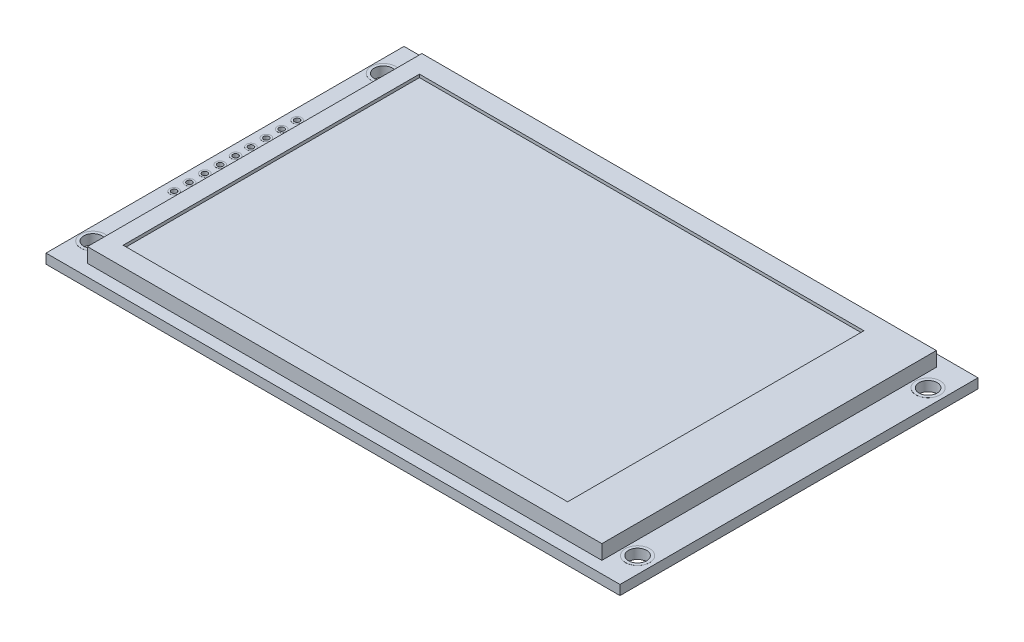
from build123d import *

# Parameters (mm, degrees)
SCHIZZO1_W                   = 94.84
SCHIZZO1_H                   = 59.15
ESTRUSIONE_ESTRUSIONE1_DEPTH = 0.8
SCHIZZO2_R                   = 1.5
TAGLIO_ESTRUSIONE1_DEPTH     = 56.909722097
SCHIZZO3_R                   = 0.445
TAGLIO_ESTRUSIONE2_DEPTH     = 56.909722097
ESTRUSIONE_ESTRUSIONE2_START = 0.01
SCHIZZO4_R                   = 2
SCHIZZO4_R_2                 = 1.5
SCHIZZO4_R_3                 = 0.745
SCHIZZO4_R_4                 = 0.445
ESTRUSIONE_ESTRUSIONE2_DEPTH = 0.01
SCHIZZO5_W                   = 85
SCHIZZO5_H                   = 55.26
ESTRUSIONE_ESTRUSIONE3_DEPTH = 2.4
SCHIZZO7_W                   = 73.44
SCHIZZO7_H                   = 48.96
TAGLIO_ESTRUSIONE3_DEPTH     = 0.5


with BuildPart() as part:
    # Schizzo1 → Estrusione-Estrusione1 (new, symmetric)
    with BuildSketch(Plane(origin=(0, 0, 0), x_dir=(1, 0, 0), z_dir=(0, 1, 0))):
        Rectangle(SCHIZZO1_W, SCHIZZO1_H)
    extrude(amount=ESTRUSIONE_ESTRUSIONE1_DEPTH, both=True)

    # Schizzo2 → Taglio-Estrusione1 (cut, through all)
    with BuildSketch(Plane(origin=(0, 0.8, 0), x_dir=(1, 0, 0), z_dir=(0, 1, 0))):
        with Locations(Location((-45.26, 24, 0), (0, 0, 270))):
            Circle(SCHIZZO2_R)
        with Locations(Location((44.75, 24, 0), (0, 0, 270))):
            Circle(SCHIZZO2_R)
        with Locations(Location((44.75, -24, 0), (0, 0, 270))):
            Circle(SCHIZZO2_R)
        with Locations(Location((-45.26, -24, 0), (0, 0, 270))):
            Circle(SCHIZZO2_R)
    extrude(amount=-TAGLIO_ESTRUSIONE1_DEPTH, mode=Mode.SUBTRACT)

    # Schizzo3 → Taglio-Estrusione2 (cut, through all)
    with BuildSketch(Plane(origin=(0, 0.8, 0), x_dir=(1, 0, 0), z_dir=(0, 1, 0))):
        with Locations(Location((-45.67, 0, 0), (0, 0, 270))):
            Circle(SCHIZZO3_R)
        with Locations(Location((-45.67, -2.54, 0), (0, 0, 270))):
            Circle(SCHIZZO3_R)
        with Locations(Location((-45.67, -5.08, 0), (0, 0, 270))):
            Circle(SCHIZZO3_R)
        with Locations(Location((-45.67, -7.62, 0), (0, 0, 270))):
            Circle(SCHIZZO3_R)
        with Locations(Location((-45.67, -10.16, 0), (0, 0, 270))):
            Circle(SCHIZZO3_R)
        with Locations(Location((-45.67, 2.54, 0), (0, 0, 270))):
            Circle(SCHIZZO3_R)
        with Locations(Location((-45.67, 5.08, 0), (0, 0, 270))):
            Circle(SCHIZZO3_R)
        with Locations(Location((-45.67, 7.62, 0), (0, 0, 270))):
            Circle(SCHIZZO3_R)
        with Locations(Location((-45.67, 10.16, 0), (0, 0, 270))):
            Circle(SCHIZZO3_R)
    extrude(amount=-TAGLIO_ESTRUSIONE2_DEPTH, mode=Mode.SUBTRACT)

    # Schizzo4 → Estrusione-Estrusione2 (add)
    # profile 1 of 13: a face of its own
    with BuildSketch(Plane(origin=(0, 0.8, 0), x_dir=(1, 0, 0), z_dir=(0, 1, 0)).offset(ESTRUSIONE_ESTRUSIONE2_START)):
        with Locations(Location((44.75, 24, 0), (0, 0, 90))):
            Circle(SCHIZZO4_R)
        with Locations(Location((44.75, 24, 0), (0, 0, 270))):
            Circle(SCHIZZO4_R_2, mode=Mode.SUBTRACT)
    # profile 2 of 13: a face of its own
    with BuildSketch(Plane(origin=(0, 0.8, 0), x_dir=(1, 0, 0), z_dir=(0, 1, 0)).offset(ESTRUSIONE_ESTRUSIONE2_START)):
        with Locations(Location((-45.26, 24, 0), (0, 0, 90))):
            Circle(SCHIZZO4_R)
        with Locations(Location((-45.26, 24, 0), (0, 0, 270))):
            Circle(SCHIZZO4_R_2, mode=Mode.SUBTRACT)
    # profile 3 of 13: a face of its own
    with BuildSketch(Plane(origin=(0, 0.8, 0), x_dir=(1, 0, 0), z_dir=(0, 1, 0)).offset(ESTRUSIONE_ESTRUSIONE2_START)):
        with Locations(Location((-45.26, -24, 0), (0, 0, 90))):
            Circle(SCHIZZO4_R)
        with Locations(Location((-45.26, -24, 0), (0, 0, 270))):
            Circle(SCHIZZO4_R_2, mode=Mode.SUBTRACT)
    # profile 4 of 13: a face of its own
    with BuildSketch(Plane(origin=(0, 0.8, 0), x_dir=(1, 0, 0), z_dir=(0, 1, 0)).offset(ESTRUSIONE_ESTRUSIONE2_START)):
        with Locations(Location((44.75, -24, 0), (0, 0, 90))):
            Circle(SCHIZZO4_R)
        with Locations(Location((44.75, -24, 0), (0, 0, 270))):
            Circle(SCHIZZO4_R_2, mode=Mode.SUBTRACT)
    # profile 5 of 13: a face of its own
    with BuildSketch(Plane(origin=(0, 0.8, 0), x_dir=(1, 0, 0), z_dir=(0, 1, 0)).offset(ESTRUSIONE_ESTRUSIONE2_START)):
        with Locations(Location((-45.67, 10.16, 0), (0, 0, 90))):
            Circle(SCHIZZO4_R_3)
        with Locations(Location((-45.67, 10.16, 0), (0, 0, 270))):
            Circle(SCHIZZO4_R_4, mode=Mode.SUBTRACT)
    # profile 6 of 13: a face of its own
    with BuildSketch(Plane(origin=(0, 0.8, 0), x_dir=(1, 0, 0), z_dir=(0, 1, 0)).offset(ESTRUSIONE_ESTRUSIONE2_START)):
        with Locations(Location((-45.67, 7.62, 0), (0, 0, 90))):
            Circle(SCHIZZO4_R_3)
        with Locations(Location((-45.67, 7.62, 0), (0, 0, 270))):
            Circle(SCHIZZO4_R_4, mode=Mode.SUBTRACT)
    # profile 7 of 13: a face of its own
    with BuildSketch(Plane(origin=(0, 0.8, 0), x_dir=(1, 0, 0), z_dir=(0, 1, 0)).offset(ESTRUSIONE_ESTRUSIONE2_START)):
        with Locations(Location((-45.67, 5.08, 0), (0, 0, 90))):
            Circle(SCHIZZO4_R_3)
        with Locations(Location((-45.67, 5.08, 0), (0, 0, 270))):
            Circle(SCHIZZO4_R_4, mode=Mode.SUBTRACT)
    # profile 8 of 13: a face of its own
    with BuildSketch(Plane(origin=(0, 0.8, 0), x_dir=(1, 0, 0), z_dir=(0, 1, 0)).offset(ESTRUSIONE_ESTRUSIONE2_START)):
        with Locations(Location((-45.67, 2.54, 0), (0, 0, 90))):
            Circle(SCHIZZO4_R_3)
        with Locations(Location((-45.67, 2.54, 0), (0, 0, 270))):
            Circle(SCHIZZO4_R_4, mode=Mode.SUBTRACT)
    # profile 9 of 13: a face of its own
    with BuildSketch(Plane(origin=(0, 0.8, 0), x_dir=(1, 0, 0), z_dir=(0, 1, 0)).offset(ESTRUSIONE_ESTRUSIONE2_START)):
        with Locations(Location((-45.67, 0, 0), (0, 0, 90))):
            Circle(SCHIZZO4_R_3)
        with Locations(Location((-45.67, 0, 0), (0, 0, 270))):
            Circle(SCHIZZO4_R_4, mode=Mode.SUBTRACT)
    # profile 10 of 13: a face of its own
    with BuildSketch(Plane(origin=(0, 0.8, 0), x_dir=(1, 0, 0), z_dir=(0, 1, 0)).offset(ESTRUSIONE_ESTRUSIONE2_START)):
        with Locations(Location((-45.67, -2.54, 0), (0, 0, 90))):
            Circle(SCHIZZO4_R_3)
        with Locations(Location((-45.67, -2.54, 0), (0, 0, 270))):
            Circle(SCHIZZO4_R_4, mode=Mode.SUBTRACT)
    # profile 11 of 13: a face of its own
    with BuildSketch(Plane(origin=(0, 0.8, 0), x_dir=(1, 0, 0), z_dir=(0, 1, 0)).offset(ESTRUSIONE_ESTRUSIONE2_START)):
        with Locations(Location((-45.67, -5.08, 0), (0, 0, 90))):
            Circle(SCHIZZO4_R_3)
        with Locations(Location((-45.67, -5.08, 0), (0, 0, 270))):
            Circle(SCHIZZO4_R_4, mode=Mode.SUBTRACT)
    # profile 12 of 13: a face of its own
    with BuildSketch(Plane(origin=(0, 0.8, 0), x_dir=(1, 0, 0), z_dir=(0, 1, 0)).offset(ESTRUSIONE_ESTRUSIONE2_START)):
        with Locations(Location((-45.67, -7.62, 0), (0, 0, 90))):
            Circle(SCHIZZO4_R_3)
        with Locations(Location((-45.67, -7.62, 0), (0, 0, 270))):
            Circle(SCHIZZO4_R_4, mode=Mode.SUBTRACT)
    # profile 13 of 13: a face of its own
    with BuildSketch(Plane(origin=(0, 0.8, 0), x_dir=(1, 0, 0), z_dir=(0, 1, 0)).offset(ESTRUSIONE_ESTRUSIONE2_START)):
        with Locations(Location((-45.67, -10.16, 0), (0, 0, 90))):
            Circle(SCHIZZO4_R_3)
        with Locations(Location((-45.67, -10.16, 0), (0, 0, 270))):
            Circle(SCHIZZO4_R_4, mode=Mode.SUBTRACT)
    estrusione_estrusione2 = extrude(amount=-ESTRUSIONE_ESTRUSIONE2_DEPTH)

    # Specchia1: Estrusione-Estrusione2 across plane
    add(estrusione_estrusione2.mirror(Plane.ZX))

    # Schizzo5 → Estrusione-Estrusione3 (add)
    with BuildSketch(Plane(origin=(0, 0.8, 0), x_dir=(1, 0, 0), z_dir=(0, 1, 0))):
        with Locations((-0.02, 0)):
            Rectangle(SCHIZZO5_W, SCHIZZO5_H)
    extrude(amount=ESTRUSIONE_ESTRUSIONE3_DEPTH)

    # Schizzo7 → Taglio-Estrusione3 (cut)
    with BuildSketch(Plane(origin=(0, 3.2, 0), x_dir=(1, 0, 0), z_dir=(0, 1, 0))):
        with Locations((-3.05, 0)):
            Rectangle(SCHIZZO7_W, SCHIZZO7_H)
    extrude(amount=-TAGLIO_ESTRUSIONE3_DEPTH, mode=Mode.SUBTRACT)


solid = part.part
